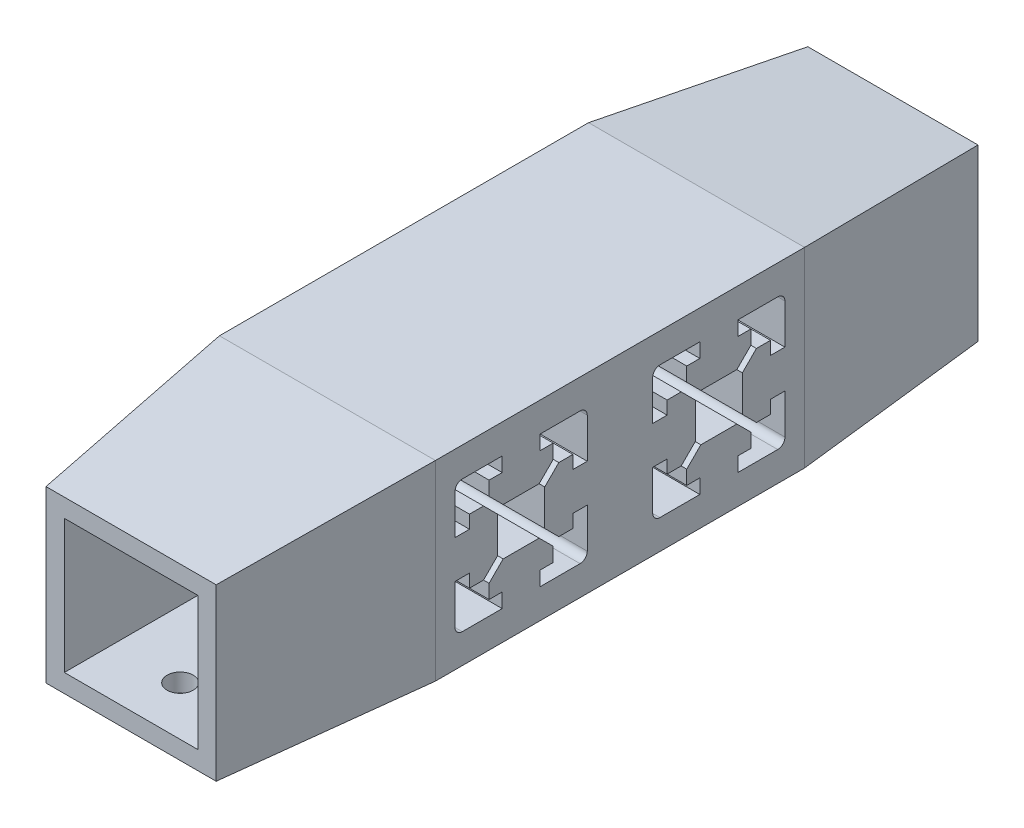
from build123d import *

# Parameters (mm, degrees)
SKETCH3_W           = 28.2
SKETCH3_H           = 29.2
BOSS_EXTRUDE1_DEPTH = 3
BOSS_EXTRUDE2_START = 3
SKETCH3_3_W         = 28.2
SKETCH3_3_H         = 29.2
BOSS_EXTRUDE2_DEPTH = 30
SKETCH6_4_W         = 10.2
SKETCH6_4_H         = 20.4
CUT_EXTRUDE2_DEPTH  = 30
SKETCH8_R           = 2
CUT_EXTRUDE3_DEPTH  = 30


with BuildPart() as part:
    # Sketch3 → Boss-Extrude1 (new body)
    with BuildSketch(Plane(origin=(0, 0, 0), x_dir=(0, 0, -1), z_dir=(1, 0, 0))):
        with Locations((-1, 0)):
            Rectangle(SKETCH3_W, SKETCH3_H)
    extrude(amount=BOSS_EXTRUDE1_DEPTH)

    # Sketch3<3> → Boss-Extrude2 (add)
    with BuildSketch(Plane(origin=(0, 0, 0), x_dir=(0, 0, -1), z_dir=(1, 0, 0)).offset(BOSS_EXTRUDE2_START)):
        with Locations((-1, 0)):
            Rectangle(SKETCH3_3_W, SKETCH3_3_H)
        with BuildLine():
            Line((-10.1, 2.9), (-10.1, 9))
            ThreePointArc((-10.1, 9), (-9.777817459, 9.777817459), (-9, 10.1))
            Line((-9, 10.1), (-2.9, 10.1))
            Line((-2.9, 10.1), (-2.9, 7.9))
            Line((-2.9, 7.9), (-4.9, 7.9))
            Line((-4.9, 7.9), (-4.9, 5.749))
            Line((-4.9, 5.749), (-2.7515, 3.6005))
            Line((-2.7515, 3.6005), (2.7515, 3.6005))
            Line((2.7515, 3.6005), (4.9, 5.749))
            Line((4.9, 5.749), (4.9, 7.9))
            Line((4.9, 7.9), (2.9, 7.9))
            Line((2.9, 7.9), (2.9, 10.1))
            Line((2.9, 10.1), (9, 10.1))
            ThreePointArc((9, 10.1), (9.777817459, 9.777817459), (10.1, 9))
            Line((10.1, 9), (10.1, 2.9))
            Line((10.1, 2.9), (7.9, 2.9))
            Line((7.9, 2.9), (7.9, 4.9))
            Line((7.9, 4.9), (5.749, 4.9))
            Line((5.749, 4.9), (3.6005, 2.7515))
            Line((3.6005, 2.7515), (3.6005, -2.7515))
            Line((3.6005, -2.7515), (5.749, -4.9))
            Line((5.749, -4.9), (7.9, -4.9))
            Line((7.9, -4.9), (7.9, -2.9))
            Line((7.9, -2.9), (10.1, -2.9))
            Line((10.1, -2.9), (10.1, -9))
            ThreePointArc((10.1, -9), (9.777817459, -9.777817459), (9, -10.1))
            Line((9, -10.1), (2.9, -10.1))
            Line((2.9, -10.1), (2.9, -7.9))
            Line((2.9, -7.9), (4.9, -7.9))
            Line((4.9, -7.9), (4.9, -5.749))
            Line((4.9, -5.749), (2.7515, -3.6005))
            Line((2.7515, -3.6005), (-2.7515, -3.6005))
            Line((-2.7515, -3.6005), (-4.9, -5.749))
            Line((-4.9, -5.749), (-4.9, -7.9))
            Line((-4.9, -7.9), (-2.9, -7.9))
            Line((-2.9, -7.9), (-2.9, -10.1))
            Line((-2.9, -10.1), (-9, -10.1))
            ThreePointArc((-9, -10.1), (-9.777817459, -9.777817459), (-10.1, -9))
            Line((-10.1, -9), (-10.1, -2.9))
            Line((-10.1, -2.9), (-7.9, -2.9))
            Line((-7.9, -2.9), (-7.9, -4.9))
            Line((-7.9, -4.9), (-5.749, -4.9))
            Line((-5.749, -4.9), (-3.6005, -2.7515))
            Line((-3.6005, -2.7515), (-3.6005, 2.7515))
            Line((-3.6005, 2.7515), (-5.749, 4.9))
            Line((-5.749, 4.9), (-7.9, 4.9))
            Line((-7.9, 4.9), (-7.9, 2.9))
            Line((-7.9, 2.9), (-10.1, 2.9))
        make_face(mode=Mode.SUBTRACT)
    extrude(amount=BOSS_EXTRUDE2_DEPTH)

    # Sketch6 → section 1 of loft2
    with BuildSketch(Plane(origin=(0, 0, -43.1), x_dir=(-1, 0, 0), z_dir=(0, 0, -1)), mode=Mode.PRIVATE) as loft2_s1:
        with BuildLine():
            Line((-29.5, -14.6), (-3.5, -14.6))
            Line((-3.5, -14.6), (-3.5, 11.4))
            Line((-3.5, 11.4), (-29.5, 11.4))
            Line((-29.5, 11.4), (-29.5, -14.6))
        make_face()
    # loft from a face of the part (loft2)
    loft([part.faces().sort_by_distance((16.5, 0, -13.1))[0], loft2_s1.sketch])

    # Sketch6<4> → Cut-Extrude2 (cut)
    with BuildSketch(Plane(origin=(0, 0, -43.1), x_dir=(-1, 0, 0), z_dir=(0, 0, -1))):
        with Locations((-21.6, -1.6)):
            Rectangle(SKETCH6_4_W, SKETCH6_4_H)
        with Locations((-11.4, -1.6)):
            Rectangle(SKETCH6_4_W, SKETCH6_4_H)
    extrude(amount=-CUT_EXTRUDE2_DEPTH, mode=Mode.SUBTRACT)

    # Sketch8 → Cut-Extrude3 (cut)
    with BuildSketch(Plane(origin=(0, -11.8, 0), x_dir=(1, 0, 0), z_dir=(0, 1, 0))):
        with Locations(Location((16.5, 35.6, 0), (0, 0, 270))):
            Circle(SKETCH8_R)
        with Locations(Location((16.5, 20.6, 0), (0, 0, 270))):
            Circle(SKETCH8_R)
    extrude(amount=-CUT_EXTRUDE3_DEPTH, mode=Mode.SUBTRACT)

    # Mirror2: part across plane


with BuildPart() as part_1:
    add(part.part)
    add(part.part.mirror(Plane(origin=(3, 0, 15.1), x_dir=(1, 0, 0), z_dir=(0, 0, -1))))


solid = part_1.part
